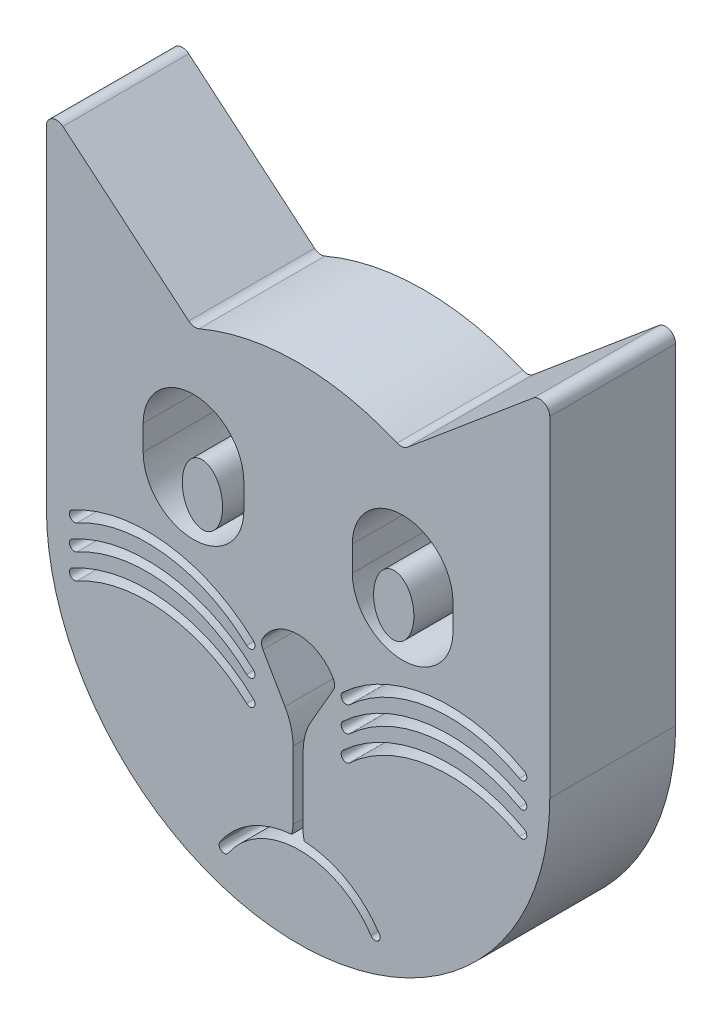
from build123d import *

# Parameters (mm, degrees)
SKETCH1_RX            = 1.524
SKETCH1_RY            = 1.016
BOSS_EXTRUDE1_DEPTH   = 6.35
BOSS_EXTRUDE1_2_DEPTH = 6.35
BOSS_EXTRUDE1_3_DEPTH = 6.35
FILLET1_R             = 0.508
FILLET2_R             = 3.048


with BuildPart() as part:
    # Sketch1 → Boss-Extrude1 (new body)
    with BuildSketch(Plane.XY):
        with Locations(Location((141.224, 68.008052795), (0, 0, -88.460840042))):
            Ellipse(SKETCH1_RX, SKETCH1_RY)
    extrude(amount=BOSS_EXTRUDE1_DEPTH)


with BuildPart() as body_2:
    # Sketch1 → Boss-Extrude1 2 (new body)
    with BuildSketch(Plane.XY):
        with Locations(Location((150.876, 68.008052795), (0, 0, -91.539159958))):
            Ellipse(SKETCH1_RX, SKETCH1_RY)
    extrude(amount=BOSS_EXTRUDE1_2_DEPTH)


with BuildPart() as body_3:
    # Sketch1 → Boss-Extrude1 3 (new body)
    with BuildSketch(Plane.XY):
        with BuildLine():
            Line((133.35, 81.28), (133.35, 63.5))
            ThreePointArc((133.35, 63.5), (146.05, 50.8), (158.75, 63.5))
            Line((158.75, 63.5), (158.75, 81.28))
            Line((158.75, 81.28), (151.327309744, 75.051623344))
            ThreePointArc((151.327309744, 75.051623344), (146.05, 76.2), (140.772690256, 75.051623344))
            Line((140.772690256, 75.051623344), (133.35, 81.28))
        make_face()
        with BuildLine():
            Line((145.796, 59.69), (145.796, 55.88))
            ThreePointArc((145.796, 55.88), (145.779685122, 55.648471272), (145.73106293, 55.421518393))
            ThreePointArc((145.73106293, 55.421518393), (143.673299342, 54.766502726), (142.10722074, 53.279615266))
            ThreePointArc((142.10722074, 53.279615266), (142.178483624, 52.927544816), (142.530554073, 52.9988077))
            ThreePointArc((142.530554073, 52.9988077), (146.128887407, 54.929943393), (149.72722074, 52.9988077))
            ThreePointArc((149.72722074, 52.9988077), (150.07929119, 52.927544816), (150.150554073, 53.279615266))
            ThreePointArc((150.150554073, 53.279615266), (148.5147686, 54.806922169), (146.36591099, 55.432119305))
            ThreePointArc((146.36591099, 55.432119305), (146.319550986, 55.653930272), (146.304, 55.88))
            Line((146.304, 55.88), (146.304, 59.69))
            ThreePointArc((146.304, 59.69), (146.269970453, 59.817), (146.177, 59.909970453))
            Line((146.177, 59.909970453), (147.955, 62.989556788))
            ThreePointArc((147.955, 62.989556788), (146.05, 64.314450714), (144.145, 62.989556788))
            Line((144.145, 62.989556788), (145.923, 59.909970453))
            ThreePointArc((145.923, 59.909970453), (145.830029547, 59.817), (145.796, 59.69))
        make_face(mode=Mode.SUBTRACT)
        with BuildLine():
            Line((143.312690256, 69.631762854), (143.312690256, 68.361762854))
            ThreePointArc((143.312690256, 68.361762854), (140.772690256, 65.821762854), (138.232690256, 68.361762854))
            Line((138.232690256, 68.361762854), (138.232690256, 69.631762854))
            ThreePointArc((138.232690256, 69.631762854), (140.772690256, 72.171762854), (143.312690256, 69.631762854))
        make_face(mode=Mode.SUBTRACT)
        with BuildLine():
            Line((148.787309744, 69.631762854), (148.787309744, 68.361762854))
            ThreePointArc((148.787309744, 68.361762854), (151.327309744, 65.821762854), (153.867309744, 68.361762854))
            Line((153.867309744, 68.361762854), (153.867309744, 69.631762854))
            ThreePointArc((153.867309744, 69.631762854), (151.327309744, 72.171762854), (148.787309744, 69.631762854))
        make_face(mode=Mode.SUBTRACT)
        with BuildLine():
            ThreePointArc((148.304846636, 61.64324608), (152.698387061, 63.693823923), (157.460327288, 62.781687841))
            ThreePointArc((157.460327288, 62.781687841), (157.560693757, 62.436784127), (157.215790043, 62.336417658))
            ThreePointArc((157.215790043, 62.336417658), (152.761071767, 63.18970625), (148.650985563, 61.271423753))
            ThreePointArc((148.650985563, 61.271423753), (148.292004936, 61.284265453), (148.304846636, 61.64324608))
        make_face(mode=Mode.SUBTRACT)
        with BuildLine():
            ThreePointArc((148.650985563, 62.541423753), (152.761071767, 64.45970625), (157.215790043, 63.606417658))
            ThreePointArc((157.215790043, 63.606417658), (157.560693757, 63.706784127), (157.460327288, 64.051687841))
            ThreePointArc((157.460327288, 64.051687841), (152.698387061, 64.963823923), (148.304846636, 62.91324608))
            ThreePointArc((148.304846636, 62.91324608), (148.292004936, 62.554265453), (148.650985563, 62.541423753))
        make_face(mode=Mode.SUBTRACT)
        with BuildLine():
            ThreePointArc((148.304846636, 60.37324608), (152.698387061, 62.423823923), (157.460327288, 61.511687841))
            ThreePointArc((157.460327288, 61.511687841), (157.560693757, 61.166784127), (157.215790043, 61.066417658))
            ThreePointArc((157.215790043, 61.066417658), (152.761071767, 61.91970625), (148.650985563, 60.001423753))
            ThreePointArc((148.650985563, 60.001423753), (148.292004936, 60.014265453), (148.304846636, 60.37324608))
        make_face(mode=Mode.SUBTRACT)
        with BuildLine():
            ThreePointArc((134.884209957, 62.336417658), (134.539306243, 62.436784127), (134.639672712, 62.781687841))
            ThreePointArc((134.639672712, 62.781687841), (139.401612939, 63.693823923), (143.795153364, 61.64324608))
            ThreePointArc((143.795153364, 61.64324608), (143.807995064, 61.284265453), (143.449014437, 61.271423753))
            ThreePointArc((143.449014437, 61.271423753), (139.338928233, 63.18970625), (134.884209957, 62.336417658))
        make_face(mode=Mode.SUBTRACT)
        with BuildLine():
            ThreePointArc((134.884209957, 61.066417658), (134.539306243, 61.166784127), (134.639672712, 61.511687841))
            ThreePointArc((134.639672712, 61.511687841), (139.401612939, 62.423823923), (143.795153364, 60.37324608))
            ThreePointArc((143.795153364, 60.37324608), (143.807995064, 60.014265453), (143.449014437, 60.001423753))
            ThreePointArc((143.449014437, 60.001423753), (139.338928233, 61.91970625), (134.884209957, 61.066417658))
        make_face(mode=Mode.SUBTRACT)
        with BuildLine():
            ThreePointArc((134.884209957, 63.606417658), (134.539306243, 63.706784127), (134.639672712, 64.051687841))
            ThreePointArc((134.639672712, 64.051687841), (139.401612939, 64.963823923), (143.795153364, 62.91324608))
            ThreePointArc((143.795153364, 62.91324608), (143.807995064, 62.554265453), (143.449014437, 62.541423753))
            ThreePointArc((143.449014437, 62.541423753), (139.338928233, 64.45970625), (134.884209957, 63.606417658))
        make_face(mode=Mode.SUBTRACT)
    extrude(amount=BOSS_EXTRUDE1_3_DEPTH)

    # Fillet1
    fillet1_edges = [body_3.edges().sort_by_distance(p)[0] for p in [
        (133.35, 81.28, 3.175),
        (140.772690256, 75.051623344, 3.175),
        (151.327309744, 75.051623344, 3.175),
        (158.75, 81.28, 3.175),
        (147.955, 62.989556788, 3.175),
        (144.145, 62.989556788, 3.175),
    ]]
    fillet(fillet1_edges, radius=FILLET1_R)

    # Fillet2
    fillet2_edges = [body_3.edges().sort_by_distance(p)[0] for p in [
        (146.177, 59.909970453, 3.175),
        (145.923, 59.909970453, 3.175),
    ]]
    fillet(fillet2_edges, radius=FILLET2_R)


solid = Compound([part.part, body_2.part, body_3.part])
